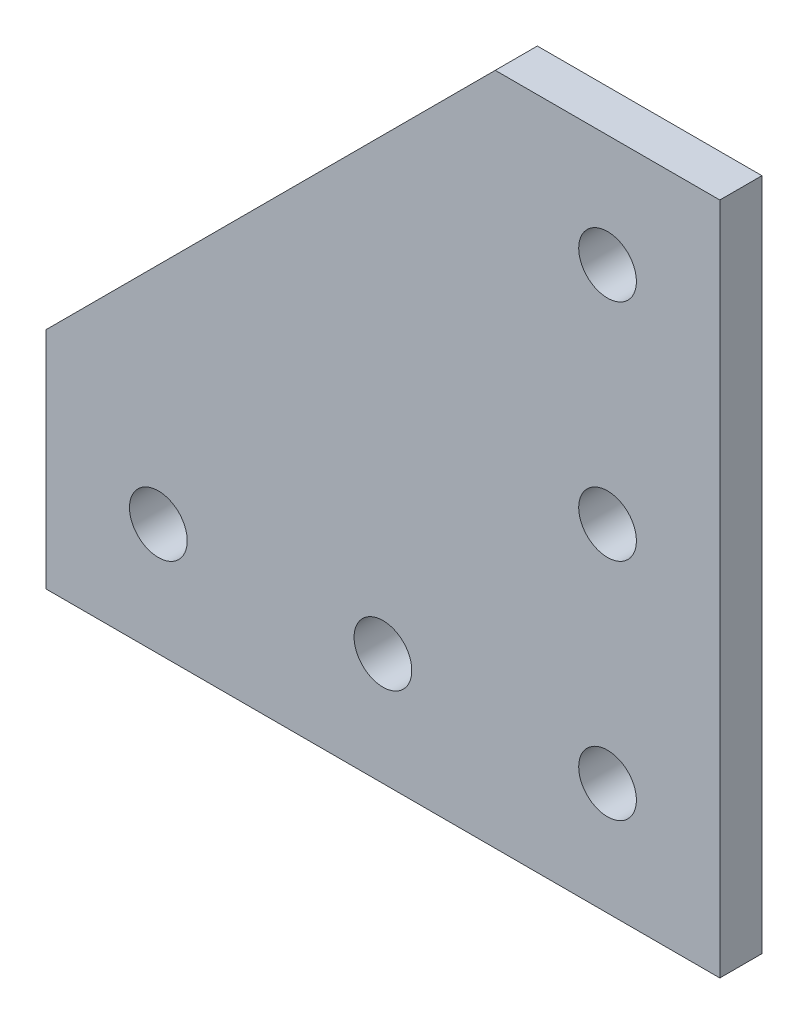
from build123d import *

# Parameters (mm, degrees)
EXTRUDE1_DEPTH  = 4.7625
SKETCH2_R       = 3.2639
SINGLE_90_DEPTH = 72.999731987


with BuildPart() as part:
    # Sketch1 → Extrude1 (new body)
    with BuildSketch(Plane.XY):
        Polygon((25.4, 25.4), (50.8, 25.4), (50.8, -50.8), (-25.4, -50.8), (-25.4, -25.4), align=None)
    extrude(amount=-EXTRUDE1_DEPTH)

    # Sketch2 → single 90 (cut, through all)
    with BuildSketch(Plane(origin=(0, 0, -4.7625), x_dir=(-1, 0, 0), z_dir=(0, 0, -1))):
        with Locations((-38.1, -38.1)):
            Circle(SKETCH2_R)
        with Locations((-12.7, -38.1)):
            Circle(SKETCH2_R)
        with Locations((12.7, -38.1)):
            Circle(SKETCH2_R)
        with Locations((-38.1, -12.7)):
            Circle(SKETCH2_R)
        with Locations((-38.1, 12.7)):
            Circle(SKETCH2_R)
    extrude(amount=-SINGLE_90_DEPTH, mode=Mode.SUBTRACT)


solid = part.part
